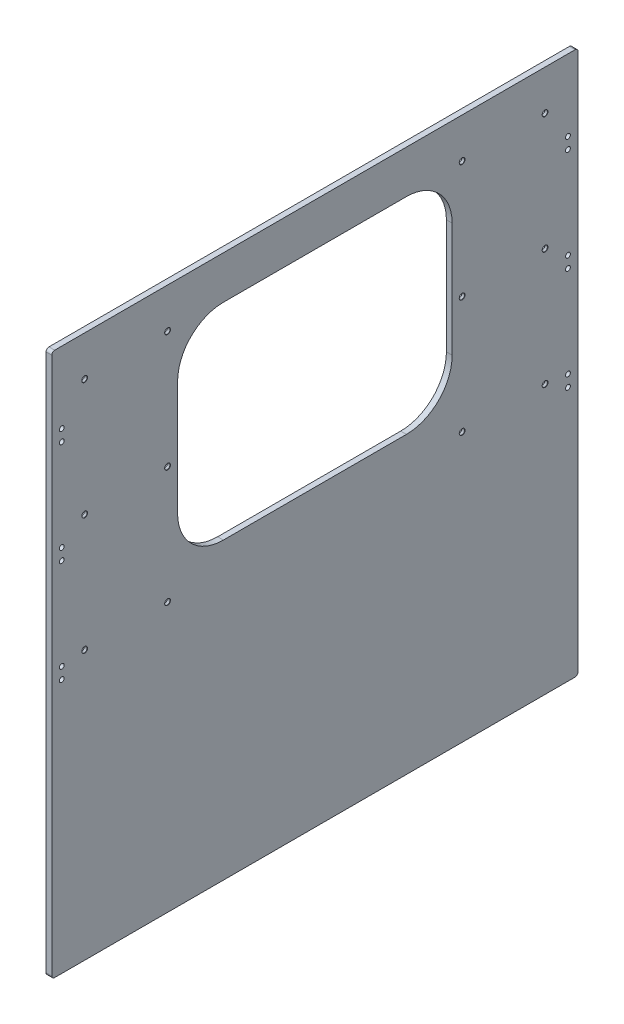
from build123d import *

# Parameters (mm, degrees)
BOSS_EXTRUDE1_DEPTH                           = 12.7
CSK_FOR_1_4_FLAT_HEAD_MACHINE_SCREW1_AT_COUNT = 2
CSK_FOR_1_4_FLAT_HEAD_MACHINE_SCREW1_AT_PITCH = 260.35
CSK_FOR_1_4_FLAT_HEAD_MACHINE_SCREW1_2_COUNT  = 2
CSK_FOR_1_4_FLAT_HEAD_MACHINE_SCREW1_2_PITCH  = 520.7
CSK_FOR_1_4_FLAT_HEAD_MACHINE_SCREW1_3_COUNT  = 2
CSK_FOR_1_4_FLAT_HEAD_MACHINE_SCREW1_3_PITCH  = 184.15
CSK_FOR_1_4_FLAT_HEAD_MACHINE_SCREW1_4_COUNT  = 2
CSK_FOR_1_4_FLAT_HEAD_MACHINE_SCREW1_4_PITCH  = 318.893940049
CSK_FOR_1_4_FLAT_HEAD_MACHINE_SCREW1_5_COUNT  = 2
CSK_FOR_1_4_FLAT_HEAD_MACHINE_SCREW1_5_PITCH  = 552.304003697
CSK_FOR_1_4_FLAT_HEAD_MACHINE_SCREW1_6_COUNT  = 2
CSK_FOR_1_4_FLAT_HEAD_MACHINE_SCREW1_6_PITCH  = 838.2
CSK_FOR_1_4_FLAT_HEAD_MACHINE_SCREW1_7_COUNT  = 2
CSK_FOR_1_4_FLAT_HEAD_MACHINE_SCREW1_7_PITCH  = 877.702319981
CSK_FOR_1_4_FLAT_HEAD_MACHINE_SCREW1_8_COUNT  = 2
CSK_FOR_1_4_FLAT_HEAD_MACHINE_SCREW1_8_PITCH  = 986.766299587
CSK_FOR_1_4_FLAT_HEAD_MACHINE_SCREW1_9_COUNT  = 2
CSK_FOR_1_4_FLAT_HEAD_MACHINE_SCREW1_9_PITCH  = 1022.35
CSK_FOR_1_4_FLAT_HEAD_MACHINE_SCREW1_10_COUNT = 2
CSK_FOR_1_4_FLAT_HEAD_MACHINE_SCREW1_10_PITCH = 1054.979452407
CSK_FOR_1_4_FLAT_HEAD_MACHINE_SCREW1_11_COUNT = 2
CSK_FOR_1_4_FLAT_HEAD_MACHINE_SCREW1_11_PITCH = 1147.313388966
F_27_64_0_42188_DIAMETER_HOLE1_D              = 10.715752


with BuildPart() as part:
    # Sketch1 → Boss-Extrude1 (new body)
    with BuildSketch(Plane(origin=(0, 0, 0), x_dir=(0, 0, -1), z_dir=(1, 0, 0))):
        with BuildLine():
            Line((6.35, 0), (1162.05, 0))
            ThreePointArc((1162.05, 0), (1166.540128061, 1.859871939), (1168.4, 6.35))
            Line((1168.4, 6.35), (1168.4, 1200.15))
            ThreePointArc((1168.4, 1200.15), (1166.540128061, 1204.640128061), (1162.05, 1206.5))
            Line((1162.05, 1206.5), (6.35, 1206.5))
            ThreePointArc((6.35, 1206.5), (1.859871939, 1204.640128061), (0, 1200.15))
            Line((0, 1200.15), (0, 6.35))
            ThreePointArc((0, 6.35), (1.859871939, 1.859871939), (6.35, 0))
        make_face()
        with BuildLine():
            Line((381, 1111.25), (787.4, 1111.25))
            ThreePointArc((787.4, 1111.25), (859.242048969, 1081.492048969), (889, 1009.65))
            Line((889, 1009.65), (889, 755.65))
            ThreePointArc((889, 755.65), (859.242048969, 683.807951031), (787.4, 654.05))
            Line((787.4, 654.05), (381, 654.05))
            ThreePointArc((381, 654.05), (309.157951031, 683.807951031), (279.4, 755.65))
            Line((279.4, 755.65), (279.4, 1009.65))
            ThreePointArc((279.4, 1009.65), (309.157951031, 1081.492048969), (381, 1111.25))
        make_face(mode=Mode.SUBTRACT)
    extrude(amount=BOSS_EXTRUDE1_DEPTH)

    # Sketch3 → CSK for 1/4 Flat Head Machine Screw1 (revolve, cut)
    with BuildSketch(Plane(origin=(12.7, 1117.6, -73.025), x_dir=(0, 0, -1), z_dir=(0, 1, 0))):
        Polygon((0, 0), (0, 12.7), (3.3782, 12.7), (3.3782, 4.536932584), (6.4389, 1.016), (6.4389, 0), align=None)
    csk_for_1_4_flat_head_machine_screw1 = revolve(axis=Axis((19.05, 1117.6, -73.025), (-1, 0, 0)), mode=Mode.SUBTRACT)

    # CSK for 1/4 Flat Head Machine Screw1 at: CSK for 1/4 Flat Head Machine Screw1 ×2
    with Locations(*[(0, -i * CSK_FOR_1_4_FLAT_HEAD_MACHINE_SCREW1_AT_PITCH, 0) for i in range(1, CSK_FOR_1_4_FLAT_HEAD_MACHINE_SCREW1_AT_COUNT)]):
        add(csk_for_1_4_flat_head_machine_screw1, mode=Mode.SUBTRACT)

    # CSK for 1_4 Flat Head Machine Screw1 2: CSK for 1/4 Flat Head Machine Screw1 ×2
    with Locations(*[(0, -i * CSK_FOR_1_4_FLAT_HEAD_MACHINE_SCREW1_2_PITCH, 0) for i in range(1, CSK_FOR_1_4_FLAT_HEAD_MACHINE_SCREW1_2_COUNT)]):
        add(csk_for_1_4_flat_head_machine_screw1, mode=Mode.SUBTRACT)

    # CSK for 1_4 Flat Head Machine Screw1 3: CSK for 1/4 Flat Head Machine Screw1 ×2
    with Locations(*[(0, 0, -i * CSK_FOR_1_4_FLAT_HEAD_MACHINE_SCREW1_3_PITCH) for i in range(1, CSK_FOR_1_4_FLAT_HEAD_MACHINE_SCREW1_3_COUNT)]):
        add(csk_for_1_4_flat_head_machine_screw1, mode=Mode.SUBTRACT)

    # CSK for 1_4 Flat Head Machine Screw1 4: CSK for 1/4 Flat Head Machine Screw1 ×2
    with Locations(*[Vector(0, -0.8164156395068651, -0.5774647206268073) * (i * CSK_FOR_1_4_FLAT_HEAD_MACHINE_SCREW1_4_PITCH) for i in range(1, CSK_FOR_1_4_FLAT_HEAD_MACHINE_SCREW1_4_COUNT)]):
        add(csk_for_1_4_flat_head_machine_screw1, mode=Mode.SUBTRACT)

    # CSK for 1_4 Flat Head Machine Screw1 5: CSK for 1/4 Flat Head Machine Screw1 ×2
    with Locations(*[Vector(0, -0.9427778841259971, -0.3334214468250479) * (i * CSK_FOR_1_4_FLAT_HEAD_MACHINE_SCREW1_5_PITCH) for i in range(1, CSK_FOR_1_4_FLAT_HEAD_MACHINE_SCREW1_5_COUNT)]):
        add(csk_for_1_4_flat_head_machine_screw1, mode=Mode.SUBTRACT)

    # CSK for 1_4 Flat Head Machine Screw1 6: CSK for 1/4 Flat Head Machine Screw1 ×2
    with Locations(*[(0, 0, -i * CSK_FOR_1_4_FLAT_HEAD_MACHINE_SCREW1_6_PITCH) for i in range(1, CSK_FOR_1_4_FLAT_HEAD_MACHINE_SCREW1_6_COUNT)]):
        add(csk_for_1_4_flat_head_machine_screw1, mode=Mode.SUBTRACT)

    # CSK for 1_4 Flat Head Machine Screw1 7: CSK for 1/4 Flat Head Machine Screw1 ×2
    with Locations(*[Vector(0, -0.2966267652176661, -0.9549934880178522) * (i * CSK_FOR_1_4_FLAT_HEAD_MACHINE_SCREW1_7_PITCH) for i in range(1, CSK_FOR_1_4_FLAT_HEAD_MACHINE_SCREW1_7_COUNT)]):
        add(csk_for_1_4_flat_head_machine_screw1, mode=Mode.SUBTRACT)

    # CSK for 1_4 Flat Head Machine Screw1 8: CSK for 1/4 Flat Head Machine Screw1 ×2
    with Locations(*[Vector(0, -0.5276832014004726, -0.8494412510349073) * (i * CSK_FOR_1_4_FLAT_HEAD_MACHINE_SCREW1_8_PITCH) for i in range(1, CSK_FOR_1_4_FLAT_HEAD_MACHINE_SCREW1_8_COUNT)]):
        add(csk_for_1_4_flat_head_machine_screw1, mode=Mode.SUBTRACT)

    # CSK for 1_4 Flat Head Machine Screw1 9: CSK for 1/4 Flat Head Machine Screw1 ×2
    with Locations(*[(0, 0, -i * CSK_FOR_1_4_FLAT_HEAD_MACHINE_SCREW1_9_PITCH) for i in range(1, CSK_FOR_1_4_FLAT_HEAD_MACHINE_SCREW1_9_COUNT)]):
        add(csk_for_1_4_flat_head_machine_screw1, mode=Mode.SUBTRACT)

    # CSK for 1_4 Flat Head Machine Screw1 10: CSK for 1/4 Flat Head Machine Screw1 ×2
    with Locations(*[Vector(0, -0.2467820576089035, -0.9690710067081337) * (i * CSK_FOR_1_4_FLAT_HEAD_MACHINE_SCREW1_10_PITCH) for i in range(1, CSK_FOR_1_4_FLAT_HEAD_MACHINE_SCREW1_10_COUNT)]):
        add(csk_for_1_4_flat_head_machine_screw1, mode=Mode.SUBTRACT)

    # CSK for 1_4 Flat Head Machine Screw1 11: CSK for 1/4 Flat Head Machine Screw1 ×2
    with Locations(*[Vector(0, -0.4538428689212819, -0.891081730443005) * (i * CSK_FOR_1_4_FLAT_HEAD_MACHINE_SCREW1_11_PITCH) for i in range(1, CSK_FOR_1_4_FLAT_HEAD_MACHINE_SCREW1_11_COUNT)]):
        add(csk_for_1_4_flat_head_machine_screw1, mode=Mode.SUBTRACT)

    # 27/64 (0.42188) Diameter Hole1 (through all)
    with Locations(Plane(origin=(12.7, 0, 0), x_dir=(0, 0, -1), z_dir=(1, 0, 0))):
        with Locations((22.225, 1047.75), (22.225, 590.55), (1146.175, 1047.75), (1146.175, 590.55), (1146.175, 819.15), (22.225, 819.15), (22.225, 1022.35), (22.225, 793.75), (22.225, 565.15), (1146.175, 1022.35), (1146.175, 793.75), (1146.175, 565.15)):
            Hole(F_27_64_0_42188_DIAMETER_HOLE1_D / 2)


solid = part.part
